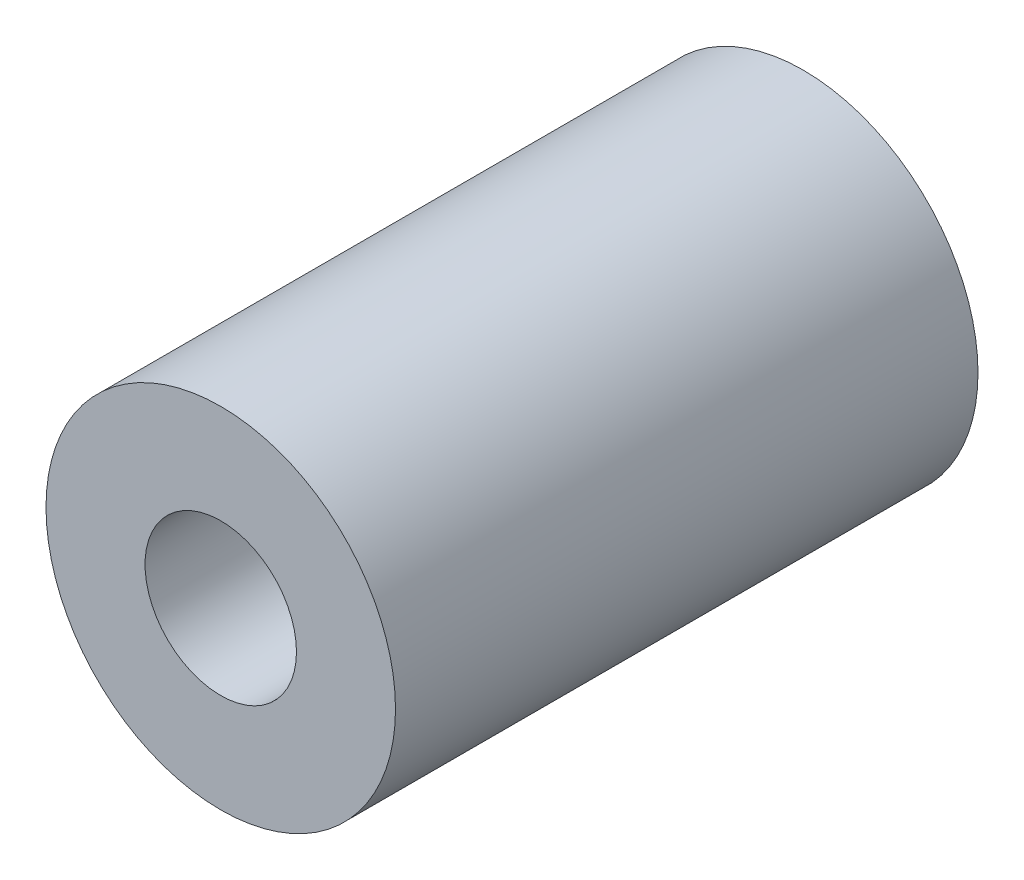
from build123d import *

# Parameters (mm, degrees)
SKETCH_1_R      = 3
SKETCH_1_R_2    = 1.3
EXTRUDE_1_DEPTH = 10


with BuildPart() as part:
    # ｽｹｯﾁ1 → ﾎﾞｽ - 押し出し1 (new body)
    with BuildSketch(Plane.XY):
        Circle(SKETCH_1_R)
        Circle(SKETCH_1_R_2, mode=Mode.SUBTRACT)
    extrude(amount=EXTRUDE_1_DEPTH)


solid = part.part
